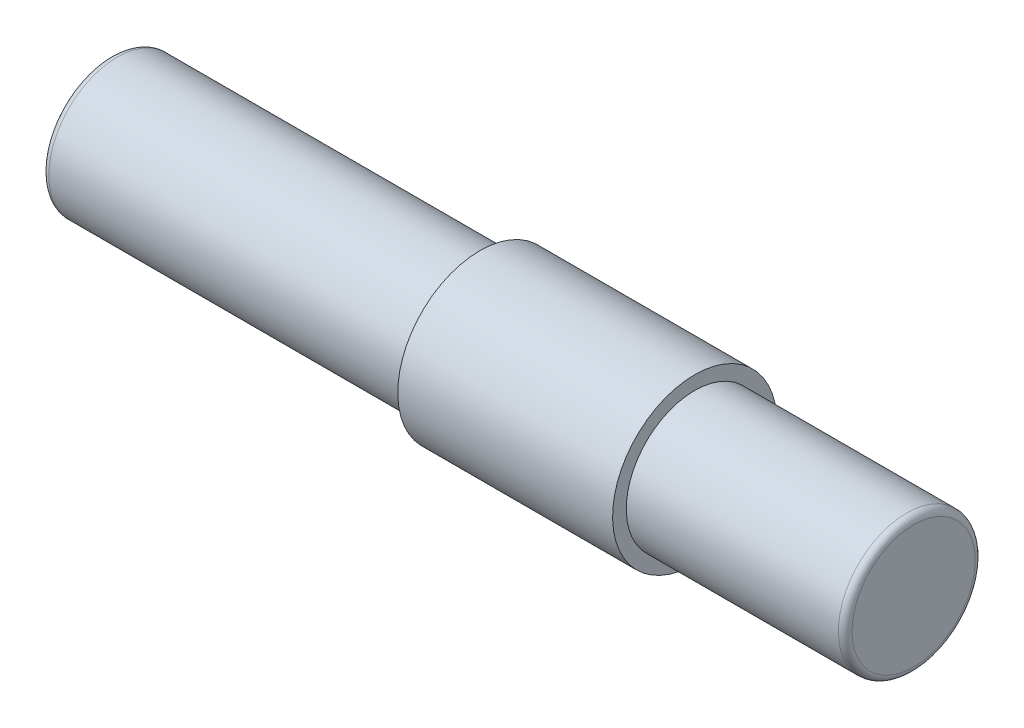
from build123d import *

# Parameters (mm, degrees)
VERRUNDUNG1_R = 0.5


with BuildPart() as part:
    # Skizze1 → Rotation1 (revolve)
    with BuildSketch(Plane.XY):
        Polygon((-78.778077973, 1.754378812), (-78.778077973, 6.754378812), (-51.778077973, 6.754378812), (-51.778077973, 7.754378812), (-36.078077973, 7.754378812), (-36.078077973, 6.754378812), (-26.078077973, 6.754378812), (-25.078077973, 6.754378812), (-20.078077973, 6.754378812), (-20.078077973, 1.754378812), align=None)
    revolve(axis=Axis((-20.078077973, 1.754378812, 0), (-1, 0, 0)))

    # Verrundung1
    verrundung1_edges = [part.edges().sort_by_distance(p)[0] for p in [
        (-78.778077973, -3.245621188, 0),
        (-20.078077973, -3.245621188, 0),
    ]]
    fillet(verrundung1_edges, radius=VERRUNDUNG1_R)


solid = part.part
